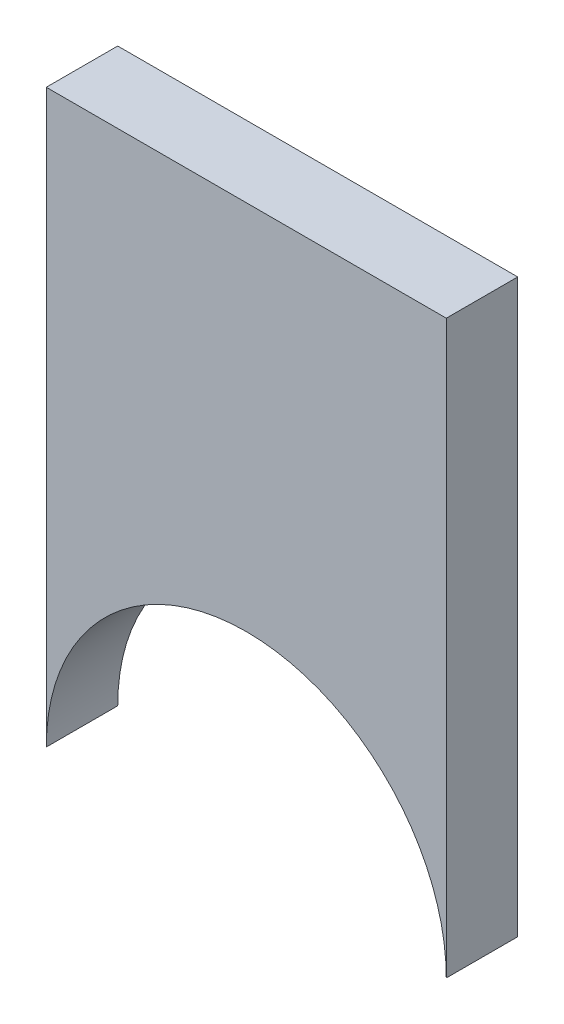
from build123d import *

# Parameters (mm, degrees)
EXTRUDE_1_DEPTH = 20


with BuildPart() as part:
    # 草图1 → 凸台-拉伸1 (new body)
    with BuildSketch(Plane.XY):
        with BuildLine():
            Line((-56, 0), (-56, 160))
            Line((-56, 160), (56, 160))
            Line((56, 160), (56, 0))
            ThreePointArc((56, 0), (0, 56), (-56, 0))
        make_face()
    extrude(amount=EXTRUDE_1_DEPTH)


solid = part.part
